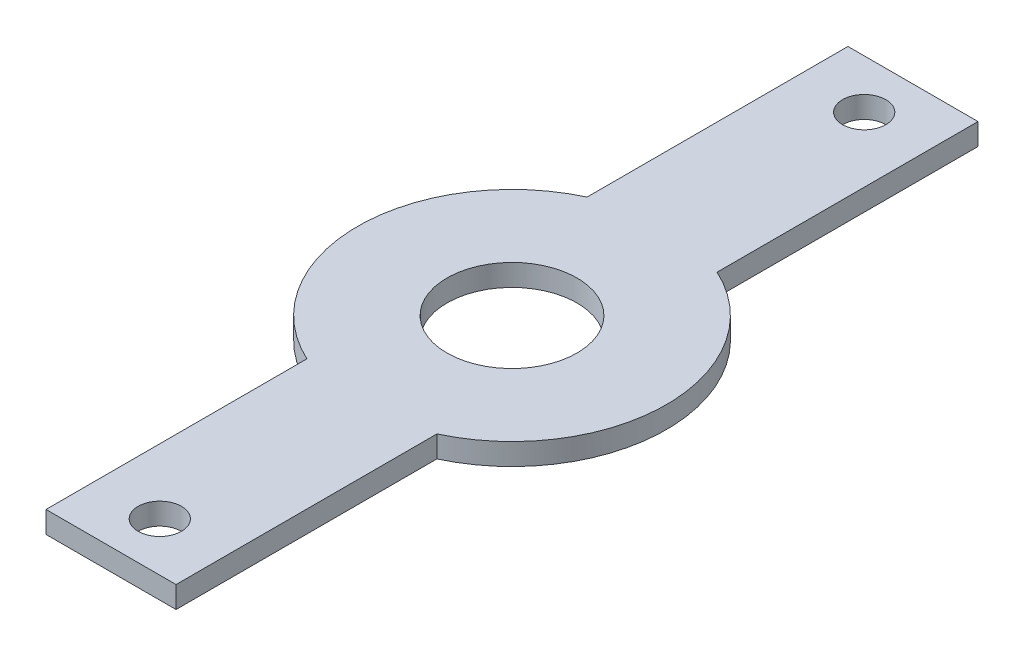
from build123d import *

# Parameters (mm, degrees)
SKETCH1_R           = 2
BOSS_EXTRUDE1_DEPTH = 2
CUT_EXTRUDE1_REACH  = 41.7
SKETCH2_R           = 6


with BuildPart() as part:
    # Sketch1 → Boss-Extrude1 (new body)
    with BuildSketch(Plane(origin=(0, 0, 0), x_dir=(1, 0, 0), z_dir=(0, 1, 0))):
        with BuildLine():
            Line((-6, 37), (6, 37))
            Line((6, 37), (6, 12.925265955))
            ThreePointArc((6, 12.925265955), (14.25, 0), (6, -12.925265955))
            Line((6, -12.925265955), (6, -37))
            Line((6, -37), (-6, -37))
            Line((-6, -37), (-6, -12.925265955))
            ThreePointArc((-6, -12.925265955), (-14.25, 0), (-6, 12.925265955))
            Line((-6, 12.925265955), (-6, 37))
        make_face()
        with Locations(Location((0, 32.5, 0), (0, 0, 270))):
            Circle(SKETCH1_R, mode=Mode.SUBTRACT)
        with Locations(Location((0, -32.5, 0), (0, 0, 90))):
            Circle(SKETCH1_R, mode=Mode.SUBTRACT)
    extrude(amount=BOSS_EXTRUDE1_DEPTH)

    # Sketch2 → Cut-Extrude1 (cut, up to next)
    with BuildSketch(Plane(origin=(0, 2, 0), x_dir=(1, 0, 0), z_dir=(0, 1, 0)), mode=Mode.PRIVATE) as cut_extrude1_sk1:
        with Locations(Location((0, 0, 0), (0, 0, 270))):
            Circle(SKETCH2_R)
    cut_extrude1_tool1 = extrude(cut_extrude1_sk1.sketch, amount=-CUT_EXTRUDE1_REACH, mode=Mode.PRIVATE) & part.part
    add(cut_extrude1_tool1.solids().sort_by_distance((0, 2, 0))[0], mode=Mode.SUBTRACT)


solid = part.part
